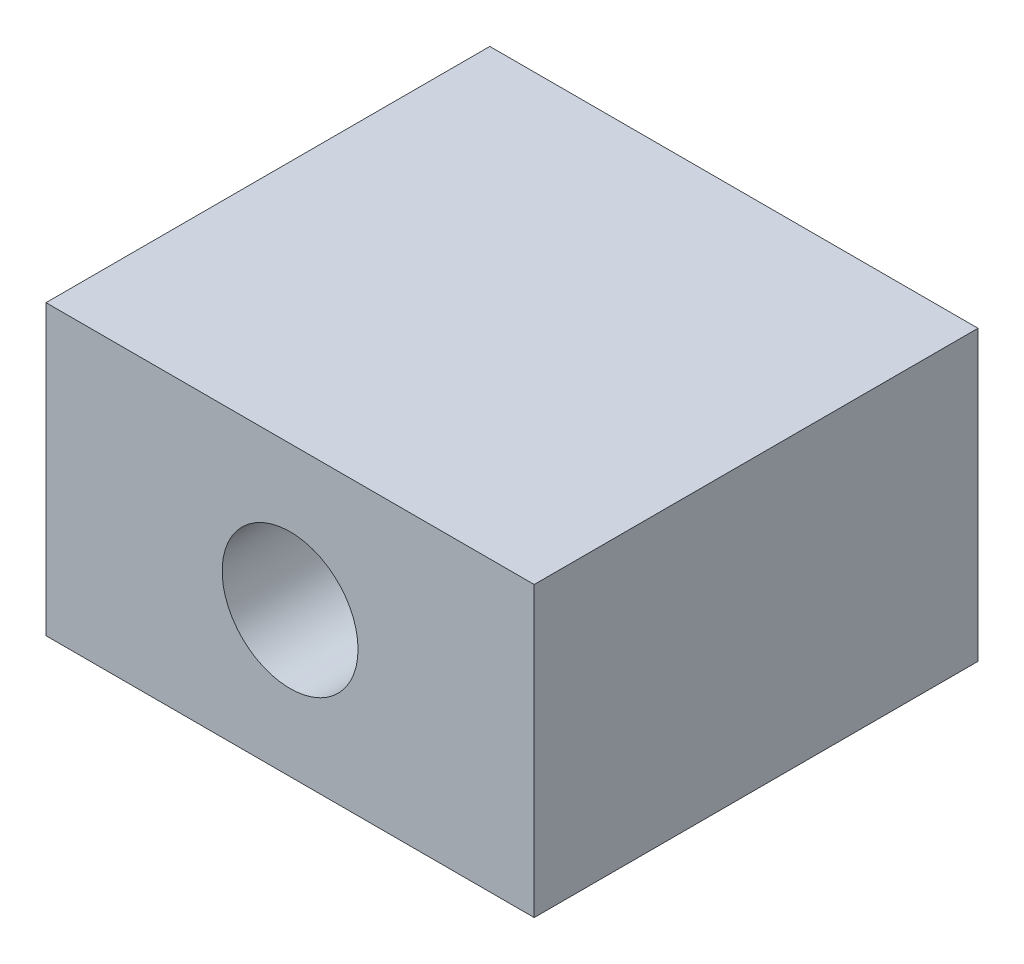
from build123d import *

# Parameters (mm, degrees)
SKETCH1_W           = 279.4
SKETCH1_H           = 165.1
BOSS_EXTRUDE1_DEPTH = 254
SKETCH2_R           = 38.8874
CUT_EXTRUDE1_DEPTH  = 302.407684872


with BuildPart() as part:
    # Sketch1 → Boss-Extrude1 (new body)
    with BuildSketch(Plane.XY):
        Rectangle(SKETCH1_W, SKETCH1_H)
    extrude(amount=BOSS_EXTRUDE1_DEPTH)

    # Sketch2 → Cut-Extrude1 (cut, through all)
    with BuildSketch(Plane.XY):
        Circle(SKETCH2_R)
    extrude(amount=CUT_EXTRUDE1_DEPTH, mode=Mode.SUBTRACT)


solid = part.part
